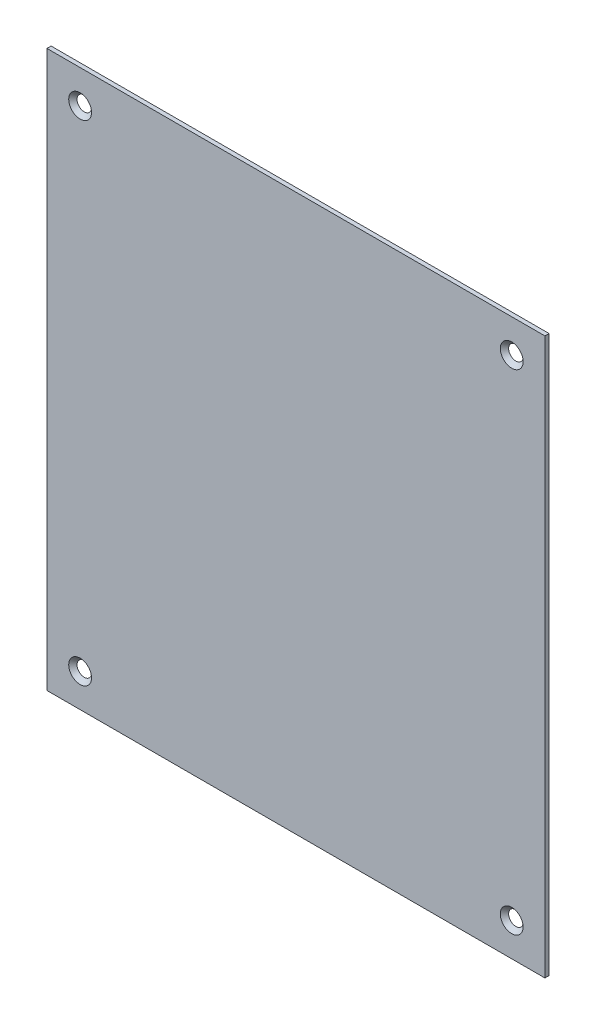
from build123d import *

# Parameters (mm, degrees)
SKETCH1_W                                      = 120
SKETCH1_H                                      = 134
BOSS_EXTRUDE2_DEPTH                            = 1
CSK_FOR_M2_5_COUNTERSUNK_FLAT_HEAD1_AT_2_COUNT = 2
CSK_FOR_M2_5_COUNTERSUNK_FLAT_HEAD1_AT_2_PITCH = 118
CSK_FOR_M2_5_COUNTERSUNK_FLAT_HEAD1_AT_3_COUNT = 2
CSK_FOR_M2_5_COUNTERSUNK_FLAT_HEAD1_AT_3_PITCH = 157.289541928
CSK_FOR_M2_5_COUNTERSUNK_FLAT_HEAD1_AT_4_COUNT = 2
CSK_FOR_M2_5_COUNTERSUNK_FLAT_HEAD1_AT_4_PITCH = 104


with BuildPart() as part:
    # Sketch1 → Boss-Extrude2 (new body)
    with BuildSketch(Plane.XY):
        with Locations((-11.134020619, -9.010309278)):
            Rectangle(SKETCH1_W, SKETCH1_H)
    extrude(amount=-BOSS_EXTRUDE2_DEPTH)

    # Sketch4 → CSK for M2.5 Countersunk Flat Head1 (revolve, cut)
    with BuildSketch(Plane(origin=(-63.134020619, 49.989690722, 0), x_dir=(0, -1, 0), z_dir=(1, 0, 0))):
        Polygon((0, 0), (0, 1.871247898), (1.45, 1), (1.45, 1.3), (2.75, 0), align=None)
    csk_for_m2_5_countersunk_flat_head1 = revolve(axis=Axis((-63.134020619, 49.989690722, 6.35), (0, 0, -1)), mode=Mode.SUBTRACT)

    # CSK for M2.5 Countersunk Flat Head1 at 2: CSK for M2.5 Countersunk Flat Head1 ×2
    with Locations(*[(0, -i * CSK_FOR_M2_5_COUNTERSUNK_FLAT_HEAD1_AT_2_PITCH, 0) for i in range(1, CSK_FOR_M2_5_COUNTERSUNK_FLAT_HEAD1_AT_2_COUNT)]):
        add(csk_for_m2_5_countersunk_flat_head1, mode=Mode.SUBTRACT)

    # CSK for M2.5 Countersunk Flat Head1 at 3: CSK for M2.5 Countersunk Flat Head1 ×2
    with Locations(*[Vector(0.661200984662022, -0.7502088095203712, 0) * (i * CSK_FOR_M2_5_COUNTERSUNK_FLAT_HEAD1_AT_3_PITCH) for i in range(1, CSK_FOR_M2_5_COUNTERSUNK_FLAT_HEAD1_AT_3_COUNT)]):
        add(csk_for_m2_5_countersunk_flat_head1, mode=Mode.SUBTRACT)

    # CSK for M2.5 Countersunk Flat Head1 at 4: CSK for M2.5 Countersunk Flat Head1 ×2
    with Locations(*[(i * CSK_FOR_M2_5_COUNTERSUNK_FLAT_HEAD1_AT_4_PITCH, 0, 0) for i in range(1, CSK_FOR_M2_5_COUNTERSUNK_FLAT_HEAD1_AT_4_COUNT)]):
        add(csk_for_m2_5_countersunk_flat_head1, mode=Mode.SUBTRACT)


solid = part.part
